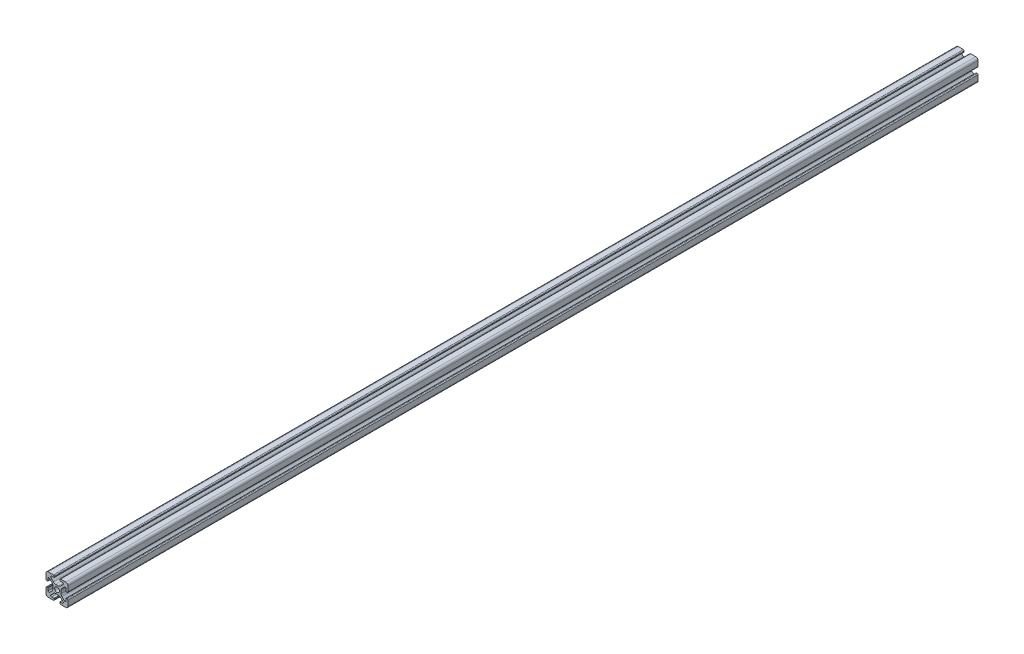
from build123d import *

# Parameters (mm, degrees)
ESQUISSE1_R        = 2.15
BOSS_EXTRU_1_DEPTH = 827


with BuildPart() as part:
    # Esquisse1 → Boss.-Extru.1 (new body)
    with BuildSketch(Plane(origin=(0, 0, 0), x_dir=(-1, 0, 0), z_dir=(0, 0, -1))):
        with BuildLine():
            Line((-20, 6.7), (-20, 2))
            ThreePointArc((-20, 2), (-19.414213562, 0.585786438), (-18, 0))
            Line((-18, 0), (-13.3, 0))
            ThreePointArc((-13.3, 0), (-12.734314575, 0.234314575), (-12.5, 0.8))
            Line((-12.5, 0.8), (-12.5, 1.5))
            ThreePointArc((-12.5, 1.5), (-12.587867966, 1.712132034), (-12.8, 1.8))
            Line((-12.8, 1.8), (-14.918424061, 1.8))
            ThreePointArc((-14.918424061, 1.8), (-15.686700051, 2.313345604), (-15.506437047, 3.219588924))
            Line((-15.506437047, 3.219588924), (-13.254705627, 5.471320344))
            ThreePointArc((-13.254705627, 5.471320344), (-12.281435581, 6.121638598), (-11.133385284, 6.35))
            Line((-11.133385284, 6.35), (-8.866614716, 6.35))
            ThreePointArc((-8.866614716, 6.35), (-7.718564419, 6.121638598), (-6.745294373, 5.471320344))
            Line((-6.745294373, 5.471320344), (-4.493562953, 3.219588924))
            ThreePointArc((-4.493562953, 3.219588924), (-4.313299949, 2.313345604), (-5.081575939, 1.8))
            Line((-5.081575939, 1.8), (-7.2, 1.8))
            ThreePointArc((-7.2, 1.8), (-7.412132034, 1.712132034), (-7.5, 1.5))
            Line((-7.5, 1.5), (-7.5, 0.8))
            ThreePointArc((-7.5, 0.8), (-7.265685425, 0.234314575), (-6.7, 0))
            Line((-6.7, 0), (-2, 0))
            ThreePointArc((-2, 0), (-0.585786438, 0.585786438), (0, 2))
            Line((0, 2), (0, 6.7))
            ThreePointArc((0, 6.7), (-0.234314575, 7.265685425), (-0.8, 7.5))
            Line((-0.8, 7.5), (-1.5, 7.5))
            ThreePointArc((-1.5, 7.5), (-1.712132034, 7.412132034), (-1.8, 7.2))
            Line((-1.8, 7.2), (-1.8, 5.081575939))
            ThreePointArc((-1.8, 5.081575939), (-2.313345604, 4.313299949), (-3.219588924, 4.493562953))
            Line((-3.219588924, 4.493562953), (-5.471320344, 6.745294373))
            ThreePointArc((-5.471320344, 6.745294373), (-6.121638598, 7.718564419), (-6.35, 8.866614716))
            Line((-6.35, 8.866614716), (-6.35, 11.133385284))
            ThreePointArc((-6.35, 11.133385284), (-6.121638598, 12.281435581), (-5.471320344, 13.254705627))
            Line((-5.471320344, 13.254705627), (-3.219588924, 15.506437047))
            ThreePointArc((-3.219588924, 15.506437047), (-2.313345604, 15.686700051), (-1.8, 14.918424061))
            Line((-1.8, 14.918424061), (-1.8, 12.8))
            ThreePointArc((-1.8, 12.8), (-1.712132034, 12.587867966), (-1.5, 12.5))
            Line((-1.5, 12.5), (-0.8, 12.5))
            ThreePointArc((-0.8, 12.5), (-0.234314575, 12.734314575), (0, 13.3))
            Line((0, 13.3), (0, 18))
            ThreePointArc((0, 18), (-0.585786438, 19.414213562), (-2, 20))
            Line((-2, 20), (-6.7, 20))
            ThreePointArc((-6.7, 20), (-7.265685425, 19.765685425), (-7.5, 19.2))
            Line((-7.5, 19.2), (-7.5, 18.5))
            ThreePointArc((-7.5, 18.5), (-7.412132034, 18.287867966), (-7.2, 18.2))
            Line((-7.2, 18.2), (-5.081575939, 18.2))
            ThreePointArc((-5.081575939, 18.2), (-4.313299949, 17.686654396), (-4.493562953, 16.780411076))
            Line((-4.493562953, 16.780411076), (-6.745294373, 14.528679656))
            ThreePointArc((-6.745294373, 14.528679656), (-7.718564419, 13.878361402), (-8.866614716, 13.65))
            Line((-8.866614716, 13.65), (-11.133385284, 13.65))
            ThreePointArc((-11.133385284, 13.65), (-12.281435581, 13.878361402), (-13.254705627, 14.528679656))
            Line((-13.254705627, 14.528679656), (-15.506437047, 16.780411076))
            ThreePointArc((-15.506437047, 16.780411076), (-15.686700051, 17.686654396), (-14.918424061, 18.2))
            Line((-14.918424061, 18.2), (-12.8, 18.2))
            ThreePointArc((-12.8, 18.2), (-12.587867966, 18.287867966), (-12.5, 18.5))
            Line((-12.5, 18.5), (-12.5, 19.2))
            ThreePointArc((-12.5, 19.2), (-12.734314575, 19.765685425), (-13.3, 20))
            Line((-13.3, 20), (-18, 20))
            ThreePointArc((-18, 20), (-19.414213562, 19.414213562), (-20, 18))
            Line((-20, 18), (-20, 13.3))
            ThreePointArc((-20, 13.3), (-19.765685425, 12.734314575), (-19.2, 12.5))
            Line((-19.2, 12.5), (-18.5, 12.5))
            ThreePointArc((-18.5, 12.5), (-18.287867966, 12.587867966), (-18.2, 12.8))
            Line((-18.2, 12.8), (-18.2, 14.918424061))
            ThreePointArc((-18.2, 14.918424061), (-17.686654396, 15.686700051), (-16.780411076, 15.506437047))
            Line((-16.780411076, 15.506437047), (-14.528679656, 13.254705627))
            ThreePointArc((-14.528679656, 13.254705627), (-13.878361402, 12.281435581), (-13.65, 11.133385284))
            Line((-13.65, 11.133385284), (-13.65, 8.866614716))
            ThreePointArc((-13.65, 8.866614716), (-13.878361402, 7.718564419), (-14.528679656, 6.745294373))
            Line((-14.528679656, 6.745294373), (-16.780411076, 4.493562953))
            ThreePointArc((-16.780411076, 4.493562953), (-17.686654396, 4.313299949), (-18.2, 5.081575939))
            Line((-18.2, 5.081575939), (-18.2, 7.2))
            ThreePointArc((-18.2, 7.2), (-18.287867966, 7.412132034), (-18.5, 7.5))
            Line((-18.5, 7.5), (-19.2, 7.5))
            ThreePointArc((-19.2, 7.5), (-19.765685425, 7.265685425), (-20, 6.7))
        make_face()
        with Locations(Location((-10, 10, 0), (0, 0, 180))):
            Circle(ESQUISSE1_R, mode=Mode.SUBTRACT)
    extrude(amount=-BOSS_EXTRU_1_DEPTH)


solid = part.part
